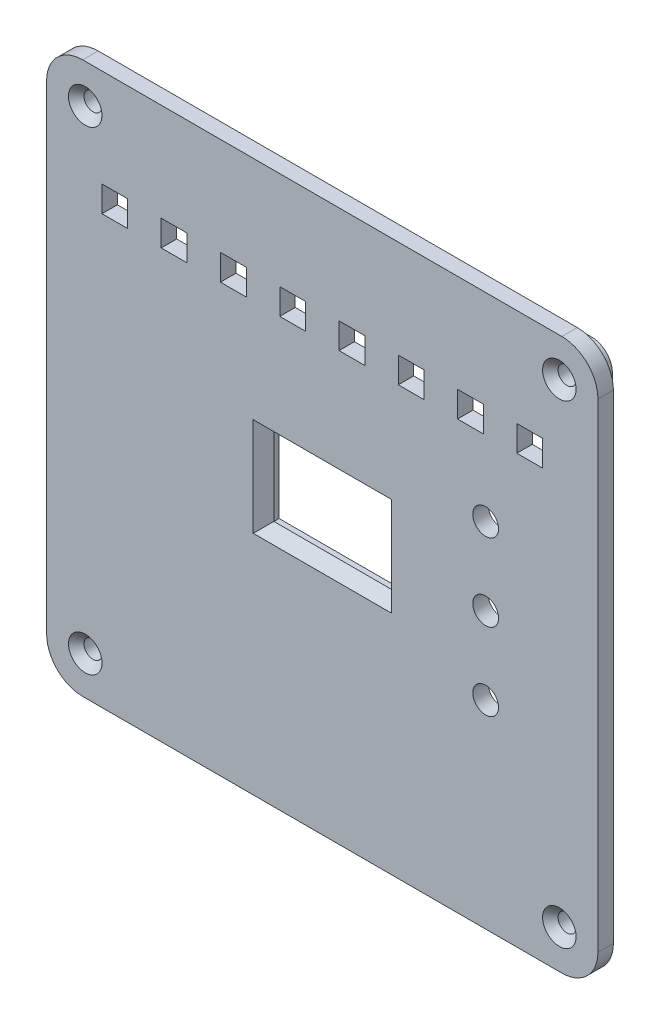
from build123d import *
from build123d.topology import SkipClean

# Parameters (mm, degrees)
ESTRUSIONE_ESTRUSIONE1_DEPTH  = 3
TAGLIO_ESTRUSIONE1_REACH      = 105.055
SCHIZZO2_R                    = 1.75
SMUSSO1_SIZE                  = 1.5
SCHIZZO3_W                    = 22.789608278
SCHIZZO3_H                    = 15.099999313
TAGLIO_ESTRUSIONE2_DEPTH      = 104.055261945
SMUSSO2_SIZE                  = 2
SCHIZZO4_R                    = 1.75
ESTRUSIONE_ESTRUSIONE2_DEPTH  = 3
TAGLIO_ESTRUSIONE3_DEPTH      = 104.18617647
TAGLIO_ESTRUSIONE3_DEPTH_BACK = 104.18617647
SCHIZZO5_R                    = 2.5
SCHIZZO5_W                    = 5
SCHIZZO5_H                    = 5


with BuildPart() as part:
    # Schizzo1 → Estrusione-Estrusione1 (new body)
    with BuildSketch(Plane.XY.offset(126.00326253)):
        with BuildLine():
            Line((-77.628669492, 58.731382705), (15.346131117, 58.731382705))
            ThreePointArc((15.346131117, 58.731382705), (20.295878585, 56.681130173), (22.346131117, 51.731382705))
            Line((22.346131117, 51.731382705), (22.346131117, -41.243417905))
            ThreePointArc((22.346131117, -41.243417905), (20.295878585, -46.193165373), (15.346131117, -48.243417905))
            Line((15.346131117, -48.243417905), (-77.628669492, -48.243417905))
            ThreePointArc((-77.628669492, -48.243417905), (-82.578416961, -46.193165373), (-84.628669492, -41.243417905))
            Line((-84.628669492, -41.243417905), (-84.628669492, 51.731382705))
            ThreePointArc((-84.628669492, 51.731382705), (-82.578416961, 56.681130173), (-77.628669492, 58.731382705))
        make_face()
    extrude(amount=ESTRUSIONE_ESTRUSIONE1_DEPTH)

    # Schizzo2 → Taglio-Estrusione1 (cut, up to next)
    with BuildSketch(Plane.XY.offset(129.00326253), mode=Mode.PRIVATE) as taglio_estrusione1_sk1:
        with Locations((-77.141361898, 51.24407511)):
            Circle(SCHIZZO2_R)
    taglio_estrusione1_tool1 = extrude(taglio_estrusione1_sk1.sketch, amount=-TAGLIO_ESTRUSIONE1_REACH, mode=Mode.PRIVATE) & part.part
    # Schizzo2 → Taglio-Estrusione1 (cut, up to next)
    with BuildSketch(Plane.XY.offset(129.00326253), mode=Mode.PRIVATE) as taglio_estrusione1_sk2:
        with Locations((14.858823522, 51.24407511)):
            Circle(SCHIZZO2_R)
    taglio_estrusione1_tool2 = extrude(taglio_estrusione1_sk2.sketch, amount=-TAGLIO_ESTRUSIONE1_REACH, mode=Mode.PRIVATE) & part.part
    # Schizzo2 → Taglio-Estrusione1 (cut, up to next)
    with BuildSketch(Plane.XY.offset(129.00326253), mode=Mode.PRIVATE) as taglio_estrusione1_sk3:
        with Locations((14.858823522, -40.75611031)):
            Circle(SCHIZZO2_R)
    taglio_estrusione1_tool3 = extrude(taglio_estrusione1_sk3.sketch, amount=-TAGLIO_ESTRUSIONE1_REACH, mode=Mode.PRIVATE) & part.part
    # Schizzo2 → Taglio-Estrusione1 (cut, up to next)
    with BuildSketch(Plane.XY.offset(129.00326253), mode=Mode.PRIVATE) as taglio_estrusione1_sk4:
        with Locations((-77.128669492, -40.768617295)):
            Circle(SCHIZZO2_R)
    taglio_estrusione1_tool4 = extrude(taglio_estrusione1_sk4.sketch, amount=-TAGLIO_ESTRUSIONE1_REACH, mode=Mode.PRIVATE) & part.part
    add(taglio_estrusione1_tool1.solids().sort_by_distance((-77.141362, 51.244075, 129.003263))[0], mode=Mode.SUBTRACT)
    add(taglio_estrusione1_tool2.solids().sort_by_distance((14.858824, 51.244075, 129.003263))[0], mode=Mode.SUBTRACT)
    add(taglio_estrusione1_tool3.solids().sort_by_distance((14.858824, -40.75611, 129.003263))[0], mode=Mode.SUBTRACT)
    add(taglio_estrusione1_tool4.solids().sort_by_distance((-77.128669, -40.768617, 129.003263))[0], mode=Mode.SUBTRACT)

    # Smusso1
    smusso1_edges = [part.edges().sort_by_distance(p)[0] for p in [
        (-78.878669492, -40.768617295, 129.00326253),
        (13.108823522, -40.75611031, 129.00326253),
        (13.108823522, 51.24407511, 129.00326253),
        (-78.891361898, 51.24407511, 129.00326253),
    ]]
    chamfer(smusso1_edges, length=SMUSSO1_SIZE)

    # Schizzo3 → Taglio-Estrusione2 (cut, through all)
    with BuildSketch(Plane.XY.offset(129.00326253)):
        with Locations((-31.141270458, 5.263005749)):
            Rectangle(SCHIZZO3_W, SCHIZZO3_H)
    extrude(amount=-TAGLIO_ESTRUSIONE2_DEPTH, mode=Mode.SUBTRACT)

    # Smusso2
    smusso2_edges = [part.edges().sort_by_distance(p)[0] for p in [
        (-42.536074597, 5.263005749, 129.00326253),
        (-31.141270458, -2.286993907, 129.00326253),
        (-19.746466319, 5.263005749, 129.00326253),
        (-31.141270458, 12.813005406, 129.00326253),
    ]]
    chamfer(smusso2_edges, length=SMUSSO2_SIZE)

    # Schizzo4 → Estrusione-Estrusione2 (add)
    with SkipClean():  # the faces are left unmerged after this step: merging them gives an invalid solid
        with BuildSketch(Plane(origin=(0, 0, 126.00326253), x_dir=(-1, 0, 0), z_dir=(0, 0, -1))):
            with BuildLine():
                ThreePointArc((81.428669492, -41.043417905), (80.257096617, -43.87184503), (77.428669492, -45.043417905))
                Line((77.428669492, -45.043417905), (-15.146131117, -45.043417905))
                ThreePointArc((-15.146131117, -45.043417905), (-17.974558242, -43.87184503), (-19.146131117, -41.043417905))
                Line((-19.146131117, -41.043417905), (-19.146131117, 51.531382705))
                ThreePointArc((-19.146131117, 51.531382705), (-17.974558242, 54.359809829), (-15.146131117, 55.531382705))
                Line((-15.146131117, 55.531382705), (77.428669492, 55.531382705))
                ThreePointArc((77.428669492, 55.531382705), (80.257096617, 54.359809829), (81.428669492, 51.531382705))
                Line((81.428669492, 51.531382705), (81.428669492, -41.043417905))
            make_face()
            with Locations((77.128669492, -40.768617295)):
                Circle(SCHIZZO4_R, mode=Mode.SUBTRACT)
            with Locations((-14.858823522, 51.24407511)):
                Circle(SCHIZZO4_R, mode=Mode.SUBTRACT)
            with Locations((77.141361898, 51.24407511)):
                Circle(SCHIZZO4_R, mode=Mode.SUBTRACT)
            with Locations((-14.858823522, -40.75611031)):
                Circle(SCHIZZO4_R, mode=Mode.SUBTRACT)
            with BuildLine():
                Line((79.428669492, -37.496003661), (79.428669492, 47.940721611))
                ThreePointArc((79.428669492, 47.940721611), (74.300242368, 48.40295558), (73.838008399, 53.531382705))
                Line((73.838008399, 53.531382705), (-11.599070717, 53.531382705))
                ThreePointArc((-11.599070717, 53.531382705), (-12.042996434, 48.428248021), (-17.146131117, 47.984322305))
                Line((-17.146131117, 47.984322305), (-17.146131117, -37.496196748))
                ThreePointArc((-17.146131117, -37.496196748), (-12.042903383, -37.940190171), (-11.59890996, -43.043417905))
                Line((-11.59890996, -43.043417905), (73.838489834, -43.043417905))
                ThreePointArc((73.838489834, -43.043417905), (74.31112355, -37.929350689), (79.428669492, -37.496003661))
            make_face(mode=Mode.SUBTRACT)
        extrude(amount=ESTRUSIONE_ESTRUSIONE2_DEPTH)

    # Schizzo5 → Taglio-Estrusione3 (cut, two sides: drawn at the far end of the back side and taken through both)
    with SkipClean():  # the faces are left unmerged after this step: merging them gives an invalid solid
        with BuildSketch(Plane.XY.offset(129.00326253).offset(-TAGLIO_ESTRUSIONE3_DEPTH_BACK)):
            with Locations(Location((0.556781358, -9.75605951, 0), (0, 0, 180))):
                Circle(SCHIZZO5_R)
            with Locations(Location((0.556781358, 5.24397097, 0), (0, 0, 180))):
                Circle(SCHIZZO5_R)
            with Locations(Location((0.556781358, 20.24399891, 0), (0, 0, 180))):
                Circle(SCHIZZO5_R)
            with Locations((-71.391349259, 37.244047119)):
                Rectangle(SCHIZZO5_W, SCHIZZO5_H)
            with Locations((-59.891326399, 37.244047119)):
                Rectangle(SCHIZZO5_W, SCHIZZO5_H)
            with Locations((-48.391303539, 37.244047119)):
                Rectangle(SCHIZZO5_W, SCHIZZO5_H)
            with Locations((-36.891280679, 37.244047119)):
                Rectangle(SCHIZZO5_W, SCHIZZO5_H)
            with Locations((-25.391257819, 37.244047119)):
                Rectangle(SCHIZZO5_W, SCHIZZO5_H)
            with Locations((-13.891234958, 37.244047119)):
                Rectangle(SCHIZZO5_W, SCHIZZO5_H)
            with Locations((-2.391212098, 37.244047119)):
                Rectangle(SCHIZZO5_W, SCHIZZO5_H)
            with Locations((9.108810762, 37.244047119)):
                Rectangle(SCHIZZO5_W, SCHIZZO5_H)
        extrude(amount=TAGLIO_ESTRUSIONE3_DEPTH + TAGLIO_ESTRUSIONE3_DEPTH_BACK, mode=Mode.SUBTRACT)


solid = part.part
